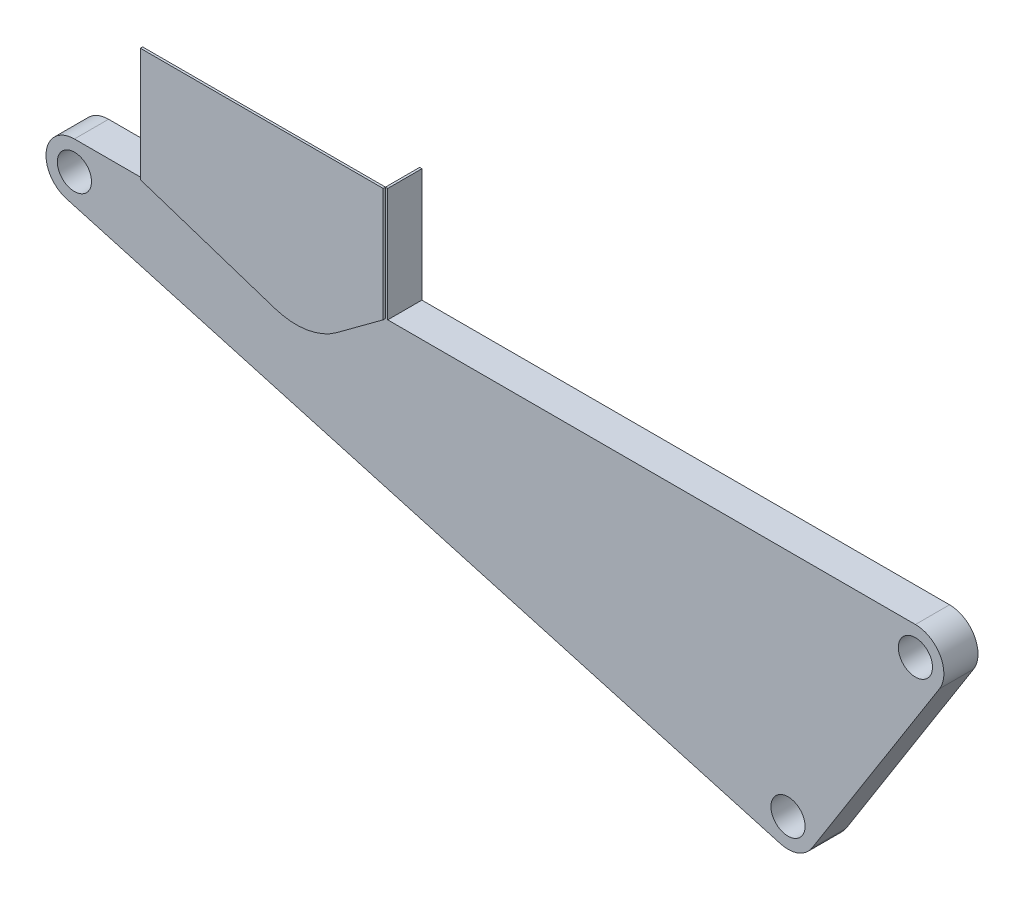
from build123d import *

# Parameters (mm, degrees)
EXTRUDE_1_DEPTH     = 0.75
SKETCH_2_R          = 0.75
CUT_EXTRUDE_1_DEPTH = 11.5
CUT_EXTRUDE_2_DEPTH = 10
SKETCH_5_W          = 0.1
SKETCH_5_H          = 1.5
EXTRUDE_3_DEPTH     = 5
EXTRUDE_4_DEPTH     = 0.1


with BuildPart() as part:
    # 草圖1 → 填料-伸長1 (new, symmetric)
    with BuildSketch(Plane.XY):
        with BuildLine():
            Line((0, 1.25), (36.94, 1.25))
            ThreePointArc((36.94, 1.25), (38.034878383, 0.603109713), (37.99653086, -0.668013878))
            Line((37.99653086, -0.668013878), (32.401246615, -9.517516363))
            ThreePointArc((32.401246615, -9.517516363), (31.791964157, -10.016750901), (31.005081794, -10.052477452))
            Line((31.005081794, -10.052477452), (-0.339633961, -1.202974968))
            ThreePointArc((-0.339633961, -1.202974968), (-1.238187932, 0.171437001), (0, 1.25))
        make_face()
    extrude(amount=EXTRUDE_1_DEPTH, both=True)

    # 草圖2 → 除料-伸長1 (cut)
    with BuildSketch(Plane.XY.offset(0.75)):
        with Locations((31.344715755, -8.849502484)):
            Circle(SKETCH_2_R)
        with Locations((36.94, 0)):
            Circle(SKETCH_2_R)
        Circle(SKETCH_2_R)
    extrude(amount=-CUT_EXTRUDE_1_DEPTH, mode=Mode.SUBTRACT)

    # 草圖3 → 除料-伸長2 (cut)
    with BuildSketch(Plane.XY.offset(0.75)):
        with BuildLine():
            Line((2.992512824, 1.25), (8.900901485, -0.693316422))
            ThreePointArc((8.900901485, -0.693316422), (10.31317825, -0.80567075), (11.61953303, -0.257413197))
            Line((11.61953303, -0.257413197), (13.662279188, 1.25))
            Line((13.662279188, 1.25), (2.992512824, 1.25))
        make_face()
    extrude(amount=-CUT_EXTRUDE_2_DEPTH, mode=Mode.SUBTRACT)

    # 草圖5 → 填料-伸長3 (add)
    with BuildSketch(Plane(origin=(0, 1.25, 0), x_dir=(1, 0, 0), z_dir=(0, 1, 0))):
        with Locations((13.712279188, 0)):
            Rectangle(SKETCH_5_W, SKETCH_5_H)
    extrude(amount=EXTRUDE_3_DEPTH)


with BuildPart() as body_2:
    # 草圖6 → 填料-伸長4 (new body)
    with BuildSketch(Plane.XY.offset(0.75)):
        with BuildLine():
            Line((13.662279188, 6.25), (13.662279188, 1.25))
            Line((13.662279188, 1.25), (11.61953303, -0.257413197))
            ThreePointArc((11.61953303, -0.257413197), (10.31317825, -0.80567075), (8.900901485, -0.693316422))
            Line((8.900901485, -0.693316422), (2.992512824, 1.25))
            Line((2.992512824, 1.25), (2.992512824, 6.25))
            Line((2.992512824, 6.25), (13.662279188, 6.25))
        make_face()
    extrude(amount=EXTRUDE_4_DEPTH)


solid = Compound([part.part, body_2.part])
